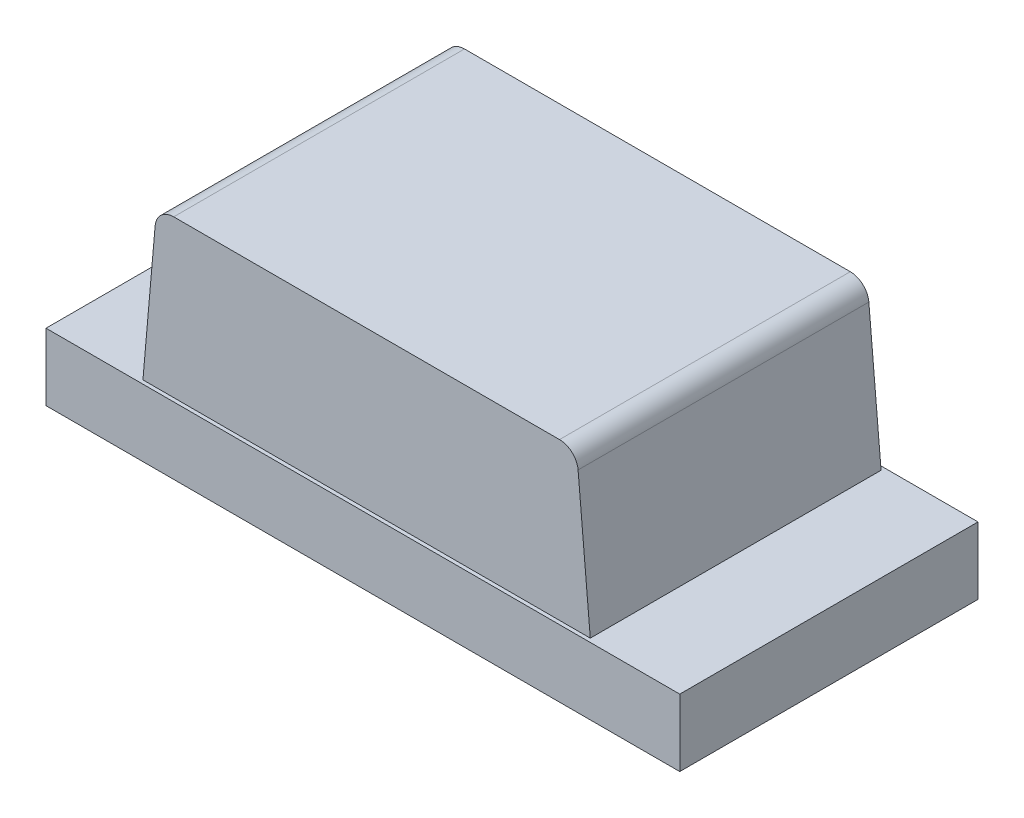
from build123d import *

# Parameters (mm, degrees)
SKETCH1_W       = 1.7
SKETCH1_H       = 0.8
BASE_DEPTH      = 0.18
LENS_DEPTH      = 0.39
LENS_DEPTH_BACK = 0.39
LENS_ROUNDS_R   = 0.05


with BuildPart() as part:
    # Sketch1 → Base (new body)
    with BuildSketch(Plane(origin=(0, 0, 0), x_dir=(1, 0, 0), z_dir=(0, 1, 0))):
        Rectangle(SKETCH1_W, SKETCH1_H)
    extrude(amount=BASE_DEPTH)

    # Sketch2 → Lens (add, two sides: drawn at the far end of the back side and taken through both)
    with BuildSketch(Plane.XY.offset(-LENS_DEPTH_BACK)):
        Polygon((-0.6, 0.18), (-0.563254761, 0.6), (0.563254761, 0.6), (0.6, 0.18), align=None)
    extrude(amount=LENS_DEPTH + LENS_DEPTH_BACK)

    # Lens Rounds
    lens_rounds_edges = [part.edges().sort_by_distance(p)[0] for p in [
        (-0.563254761, 0.6, 0),
        (0.563254761, 0.6, 0),
    ]]
    fillet(lens_rounds_edges, radius=LENS_ROUNDS_R)


solid = part.part
